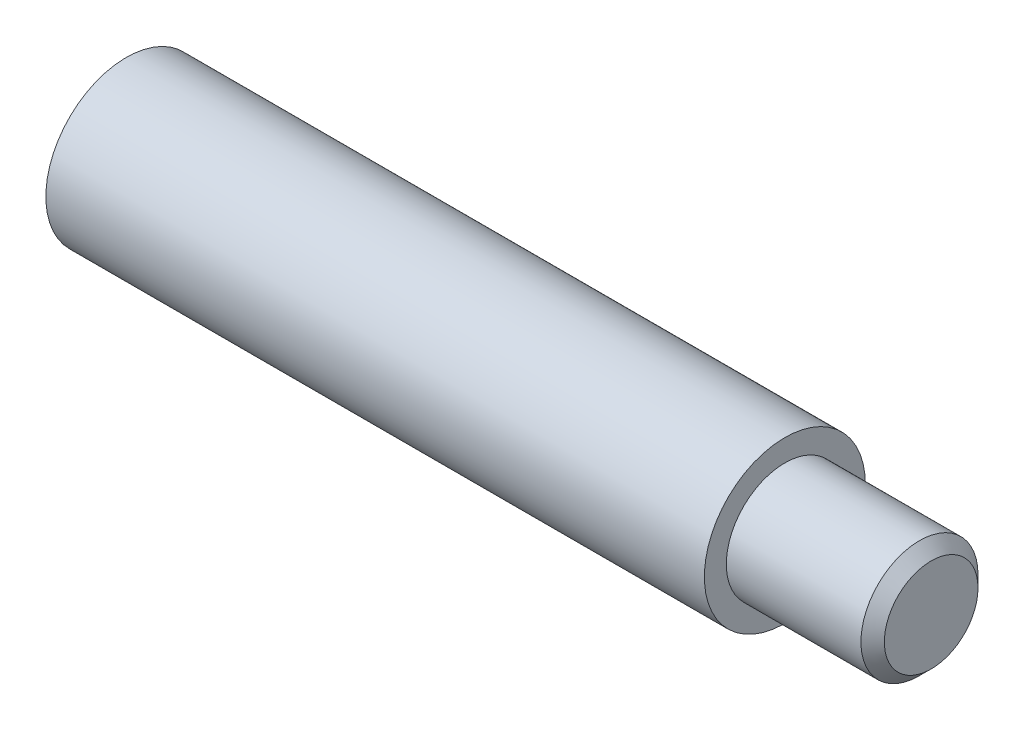
from build123d import *


with BuildPart() as part:
    # Sketch1 → Revolve1 (revolve)
    with BuildSketch(Plane.XY, mode=Mode.PRIVATE) as revolve1_sk:
        Polygon((-15.5, 2.4585), (-14.022784168, 0), (27.5, 0), (27.5, 3.2), (26.7, 4), (17.5, 4), (17.5, 5.5), (-27.5, 5.5), (-27.5, 3.2585), (-26.7, 2.4585), align=None)
    revolve(revolve1_sk.sketch.rotate(Axis((-27.5, 0, 0), (1, 0, 0)), 270), axis=Axis((-27.5, 0, 0), (1, 0, 0)))


solid = part.part
